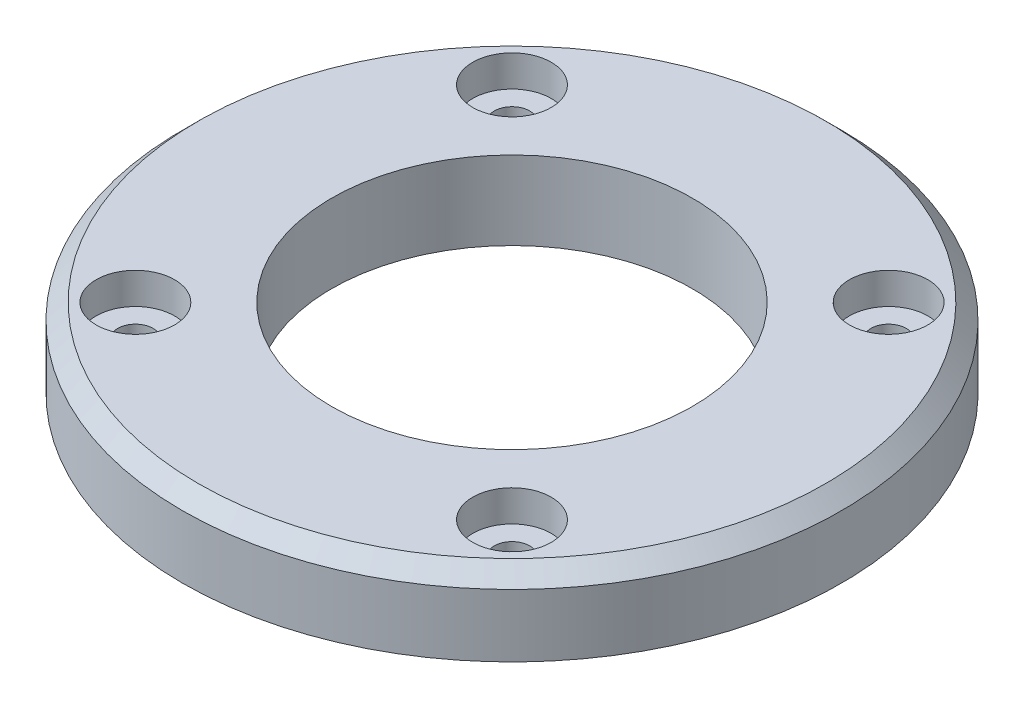
from build123d import *

# Parameters (mm, degrees)
SKETCH1_R                               = 42
SKETCH1_R_2                             = 23
EXTRUDE1_DEPTH                          = 10
CBORE_FOR_M4_HEX_HEAD_BOLT1_D           = 4.5
CBORE_FOR_M4_HEX_HEAD_BOLT1_DEPTH       = 19.75
CBORE_FOR_M4_HEX_HEAD_BOLT1_CBORE_D     = 10
CBORE_FOR_M4_HEX_HEAD_BOLT1_CBORE_DEPTH = 4
CBORE_FOR_M4_HEX_HEAD_BOLT1_TIP         = 1.351936393
CHAMFER2_SIZE                           = 2


with BuildPart() as part:
    # Sketch1 → Extrude1 (new body)
    with BuildSketch(Plane(origin=(0, 0, 0), x_dir=(1, 0, 0), z_dir=(0, 1, 0))):
        with Locations(Location((0, 0, 0), (0, 0, 270))):
            Circle(SKETCH1_R)
        with Locations(Location((0, 0, 0), (0, 0, 270))):
            Circle(SKETCH1_R_2, mode=Mode.SUBTRACT)
    extrude(amount=EXTRUDE1_DEPTH)

    # CBORE for M4 Hex Head Bolt1
    with Locations(Plane(origin=(-24, 10, -24), x_dir=(0, 0, 1), z_dir=(0, 1, 0))):
        with Locations((0, 0), (0, 48), (48, 48), (48, 0)):
            CounterBoreHole(CBORE_FOR_M4_HEX_HEAD_BOLT1_D / 2, CBORE_FOR_M4_HEX_HEAD_BOLT1_CBORE_D / 2, CBORE_FOR_M4_HEX_HEAD_BOLT1_CBORE_DEPTH, depth=CBORE_FOR_M4_HEX_HEAD_BOLT1_DEPTH)
            with Locations((0, 0, -(CBORE_FOR_M4_HEX_HEAD_BOLT1_DEPTH + CBORE_FOR_M4_HEX_HEAD_BOLT1_TIP / 2))):  # 118° drill point
                Cone(0, CBORE_FOR_M4_HEX_HEAD_BOLT1_D / 2, CBORE_FOR_M4_HEX_HEAD_BOLT1_TIP, mode=Mode.SUBTRACT)

    # Chamfer2
    chamfer2_edges = [part.edges().sort_by_distance(p)[0] for p in [
        (0, 10, -42),
    ]]
    chamfer(chamfer2_edges, length=CHAMFER2_SIZE)


solid = part.part
